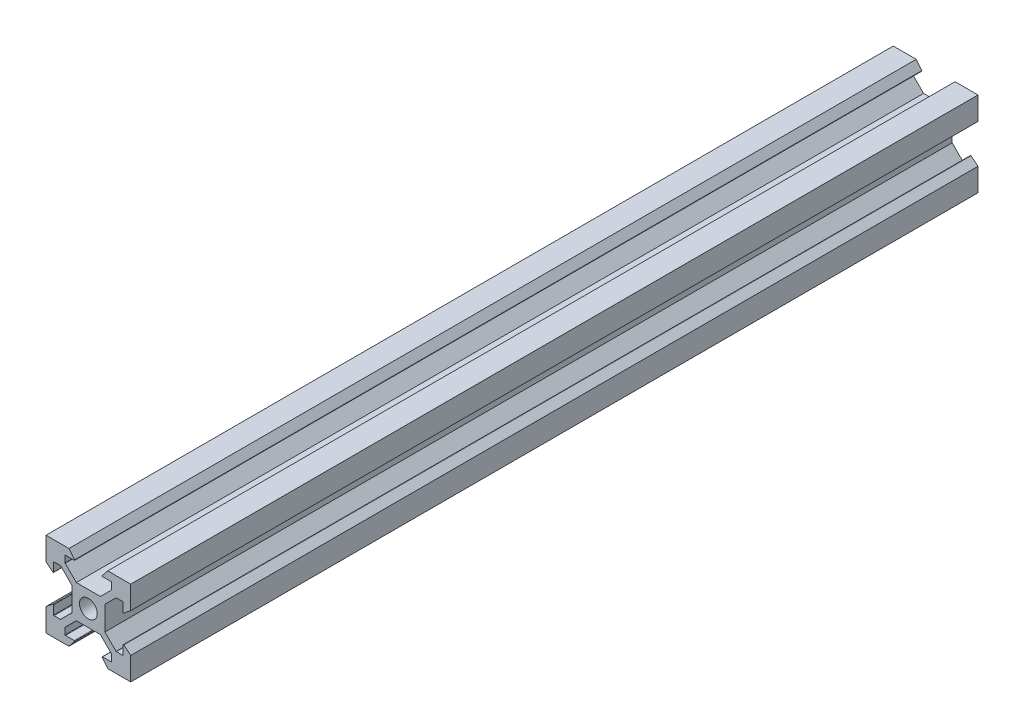
from build123d import *

# Parameters (mm, degrees)
SKETCH1_R           = 2.1
BOSS_EXTRUDE1_DEPTH = 200


with BuildPart() as part:
    # Sketch1 → Boss-Extrude1 (new body)
    with BuildSketch(Plane.XY):
        with BuildLine():
            Line((-2.839339828, 3.9), (-5.470710678, 6.53137085))
            ThreePointArc((-5.470710678, 6.53137085), (-5.492387953, 6.563813185), (-5.5, 6.602081528))
            Line((-5.5, 6.602081528), (-5.5, 8.1))
            ThreePointArc((-5.5, 8.1), (-5.470710678, 8.170710678), (-5.4, 8.2))
            Line((-5.4, 8.2), (-3.334418044, 8.2))
            ThreePointArc((-3.334418044, 8.2), (-3.244178397, 8.256909326), (-3.2566483, 8.362863876))
            Line((-3.2566483, 8.362863876), (-4.58, 10))
            Line((-4.58, 10), (-10, 10))
            Line((-10, 10), (-10, 4.58))
            Line((-10, 4.58), (-8.362863876, 3.2566483))
            ThreePointArc((-8.362863876, 3.2566483), (-8.256909326, 3.244178397), (-8.2, 3.334418044))
            Line((-8.2, 3.334418044), (-8.2, 5.4))
            ThreePointArc((-8.2, 5.4), (-8.170710678, 5.470710678), (-8.1, 5.5))
            Line((-8.1, 5.5), (-6.602081528, 5.5))
            ThreePointArc((-6.602081528, 5.5), (-6.563813185, 5.492387953), (-6.53137085, 5.470710678))
            Line((-6.53137085, 5.470710678), (-3.9, 2.839339828))
            Line((-3.9, 2.839339828), (-3.9, -2.839339828))
            Line((-3.9, -2.839339828), (-6.53137085, -5.470710678))
            ThreePointArc((-6.53137085, -5.470710678), (-6.563813185, -5.492387953), (-6.602081528, -5.5))
            Line((-6.602081528, -5.5), (-8.1, -5.5))
            ThreePointArc((-8.1, -5.5), (-8.170710678, -5.470710678), (-8.2, -5.4))
            Line((-8.2, -5.4), (-8.2, -3.334418044))
            ThreePointArc((-8.2, -3.334418044), (-8.256909326, -3.244178397), (-8.362863876, -3.2566483))
            Line((-8.362863876, -3.2566483), (-10, -4.58))
            Line((-10, -4.58), (-10, -10))
            Line((-10, -10), (-4.58, -10))
            Line((-4.58, -10), (-3.2566483, -8.362863876))
            ThreePointArc((-3.2566483, -8.362863876), (-3.244178397, -8.256909326), (-3.334418044, -8.2))
            Line((-3.334418044, -8.2), (-5.4, -8.2))
            ThreePointArc((-5.4, -8.2), (-5.470710678, -8.170710678), (-5.5, -8.1))
            Line((-5.5, -8.1), (-5.5, -6.602081528))
            ThreePointArc((-5.5, -6.602081528), (-5.492387953, -6.563813185), (-5.470710678, -6.53137085))
            Line((-5.470710678, -6.53137085), (-2.839339828, -3.9))
            Line((-2.839339828, -3.9), (2.839339828, -3.9))
            Line((2.839339828, -3.9), (5.470710678, -6.53137085))
            ThreePointArc((5.470710678, -6.53137085), (5.492387953, -6.563813185), (5.5, -6.602081528))
            Line((5.5, -6.602081528), (5.5, -8.1))
            ThreePointArc((5.5, -8.1), (5.470710678, -8.170710678), (5.4, -8.2))
            Line((5.4, -8.2), (3.334418044, -8.2))
            ThreePointArc((3.334418044, -8.2), (3.244178397, -8.256909326), (3.2566483, -8.362863876))
            Line((3.2566483, -8.362863876), (4.58, -10))
            Line((4.58, -10), (10, -10))
            Line((10, -10), (10, -4.58))
            Line((10, -4.58), (8.362863876, -3.2566483))
            ThreePointArc((8.362863876, -3.2566483), (8.256909326, -3.244178397), (8.2, -3.334418044))
            Line((8.2, -3.334418044), (8.2, -5.4))
            ThreePointArc((8.2, -5.4), (8.170710678, -5.470710678), (8.1, -5.5))
            Line((8.1, -5.5), (6.602081528, -5.5))
            ThreePointArc((6.602081528, -5.5), (6.563813185, -5.492387953), (6.53137085, -5.470710678))
            Line((6.53137085, -5.470710678), (3.9, -2.839339828))
            Line((3.9, -2.839339828), (3.9, 2.839339828))
            Line((3.9, 2.839339828), (6.53137085, 5.470710678))
            ThreePointArc((6.53137085, 5.470710678), (6.563813185, 5.492387953), (6.602081528, 5.5))
            Line((6.602081528, 5.5), (8.1, 5.5))
            ThreePointArc((8.1, 5.5), (8.170710678, 5.470710678), (8.2, 5.4))
            Line((8.2, 5.4), (8.2, 3.334418044))
            ThreePointArc((8.2, 3.334418044), (8.256909326, 3.244178397), (8.362863876, 3.2566483))
            Line((8.362863876, 3.2566483), (10, 4.58))
            Line((10, 4.58), (10, 10))
            Line((10, 10), (4.58, 10))
            Line((4.58, 10), (3.2566483, 8.362863876))
            ThreePointArc((3.2566483, 8.362863876), (3.244178397, 8.256909326), (3.334418044, 8.2))
            Line((3.334418044, 8.2), (5.4, 8.2))
            ThreePointArc((5.4, 8.2), (5.470710678, 8.170710678), (5.5, 8.1))
            Line((5.5, 8.1), (5.5, 6.602081528))
            ThreePointArc((5.5, 6.602081528), (5.492387953, 6.563813185), (5.470710678, 6.53137085))
            Line((5.470710678, 6.53137085), (2.839339828, 3.9))
            Line((2.839339828, 3.9), (-2.839339828, 3.9))
        make_face()
        Circle(SKETCH1_R, mode=Mode.SUBTRACT)
    extrude(amount=BOSS_EXTRUDE1_DEPTH)


solid = part.part
